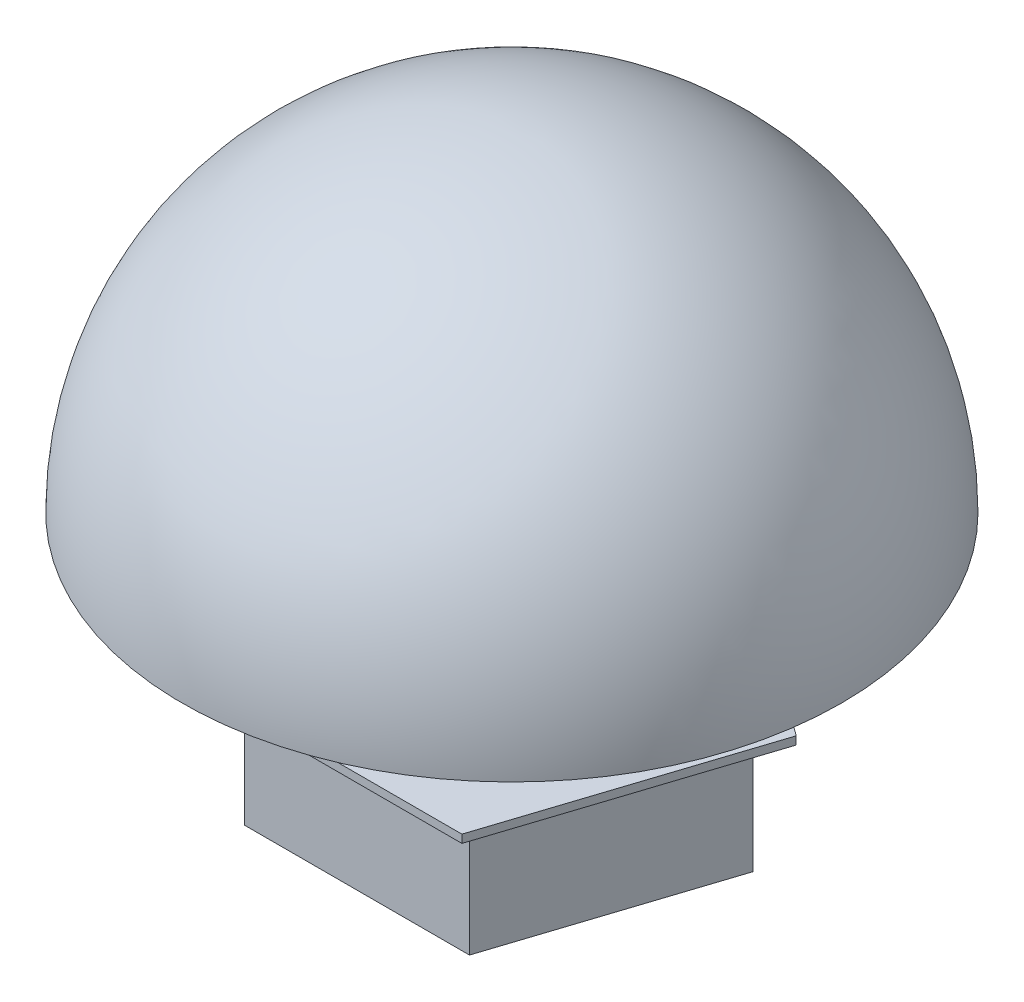
from build123d import *

# Parameters (mm, degrees)
BOSS_EXTRUDE1_DEPTH = 15
BOSS_EXTRUDE2_DEPTH = 1
SKETCH3_R           = 2.5
CUT_EXTRUDE1_DEPTH  = 2
SKETCH4_W           = 1
SKETCH4_H           = 11.716201321
BOSS_EXTRUDE4_DEPTH = 15
BOSS_EXTRUDE6_REACH = 73.014
SKETCH7_W           = 1
SKETCH7_H           = 11.716201321


with BuildPart() as part:
    # Sketch1 → Boss-Extrude1 (new body)
    with BuildSketch(Plane(origin=(0, 0, 0), x_dir=(1, 0, 0), z_dir=(0, 1, 0))):
        Polygon((-22.652475842, 7.36023557), (-14, -19.269346887), (14, -19.269346887), (22.652475842, 7.36023557), (0, 23.818222634), align=None)
        Polygon((13.273457472, -18.269346887), (21.476905338, 6.978269558), (0, 22.582154656), (-21.476905338, 6.978269558), (-13.273457472, -18.269346887), align=None, mode=Mode.SUBTRACT)
    extrude(amount=BOSS_EXTRUDE1_DEPTH)

    # Sketch2 → Boss-Extrude2 (add)
    with BuildSketch(Plane(origin=(0, 15, 0), x_dir=(1, 0, 0), z_dir=(0, 1, 0))):
        Polygon((16.5, -22.710301688), (26.697560814, 8.67456335), (0, 28.071476676), (-26.697560814, 8.67456335), (-16.5, -22.710301688), align=None)
    extrude(amount=BOSS_EXTRUDE2_DEPTH)

    # Sketch3 → Cut-Extrude1 (cut)
    with BuildSketch(Plane(origin=(0, 16, 0), x_dir=(1, 0, 0), z_dir=(0, 1, 0))):
        with Locations(Location((0, 0, 0), (0, 0, 270))):
            Circle(SKETCH3_R)
    extrude(amount=-CUT_EXTRUDE1_DEPTH, mode=Mode.SUBTRACT)

    # Sketch4 → Boss-Extrude4 (add)
    with BuildSketch(Plane(origin=(0, 16, 0), x_dir=(1, 0, 0), z_dir=(0, 1, 0))):
        with Locations((0, 13.85810066)):
            Rectangle(SKETCH4_W, SKETCH4_H)
        Polygon((17.32473121, -9.425087959), (7.17820323, -3.566987298), (6.67820323, -4.433012702), (16.82473121, -10.291113362), align=None)
        Polygon((-16.82473121, -10.291113362), (-6.67820323, -4.433012702), (-7.17820323, -3.566987298), (-17.32473121, -9.425087959), align=None)
    extrude(amount=BOSS_EXTRUDE4_DEPTH)



with BuildPart() as body_2:
    # Sketch6 → Revolve1 (revolve)
    with BuildSketch(Plane.XY, mode=Mode.PRIVATE) as revolve1_sk:
        with BuildLine():
            Line((0, 72), (0, 71))
            ThreePointArc((0, 71), (-28.284271247, 59.284271247), (-40, 31))
            Line((-40, 31), (-41, 31))
            ThreePointArc((-41, 31), (-28.991378029, 59.991378029), (0, 72))
        make_face()
    revolve(revolve1_sk.sketch.rotate(Axis((0, 31, 0), (0, 1, 0)), 180), axis=Axis((0, 31, 0), (0, 1, 0)))


with BuildPart() as part_1:
    add(part.part)

    # Sketch7 → Boss-Extrude6 (add, up to next)
    with BuildSketch(Plane(origin=(0, 31, 0), x_dir=(1, 0, 0), z_dir=(0, 1, 0)), mode=Mode.PRIVATE) as boss_extrude6_sk1:
        Polygon((17.32473121, -9.425087959), (7.17820323, -3.566987298), (6.67820323, -4.433012702), (16.82473121, -10.291113362), align=None)
    boss_extrude6_tool1 = extrude(boss_extrude6_sk1.sketch, amount=BOSS_EXTRUDE6_REACH, mode=Mode.PRIVATE) - body_2.part
    # Sketch7 → Boss-Extrude6 (add, up to next)
    with BuildSketch(Plane(origin=(0, 31, 0), x_dir=(1, 0, 0), z_dir=(0, 1, 0)), mode=Mode.PRIVATE) as boss_extrude6_sk2:
        with Locations((0, 13.85810066)):
            Rectangle(SKETCH7_W, SKETCH7_H)
    boss_extrude6_tool2 = extrude(boss_extrude6_sk2.sketch, amount=BOSS_EXTRUDE6_REACH, mode=Mode.PRIVATE) - body_2.part
    # Sketch7 → Boss-Extrude6 (add, up to next)
    with BuildSketch(Plane(origin=(0, 31, 0), x_dir=(1, 0, 0), z_dir=(0, 1, 0)), mode=Mode.PRIVATE) as boss_extrude6_sk3:
        Polygon((-16.82473121, -10.291113362), (-6.67820323, -4.433012702), (-7.17820323, -3.566987298), (-17.32473121, -9.425087959), align=None)
    boss_extrude6_tool3 = extrude(boss_extrude6_sk3.sketch, amount=BOSS_EXTRUDE6_REACH, mode=Mode.PRIVATE) - body_2.part
    add(boss_extrude6_tool1.solids().sort_by_distance((12.001467, 31, 6.92905))[0])
    add(boss_extrude6_tool2.solids().sort_by_distance((0, 31, -13.858101))[0])
    add(boss_extrude6_tool3.solids().sort_by_distance((-12.001467, 31, 6.92905))[0])


solid = Compound([body_2.part, part_1.part])
